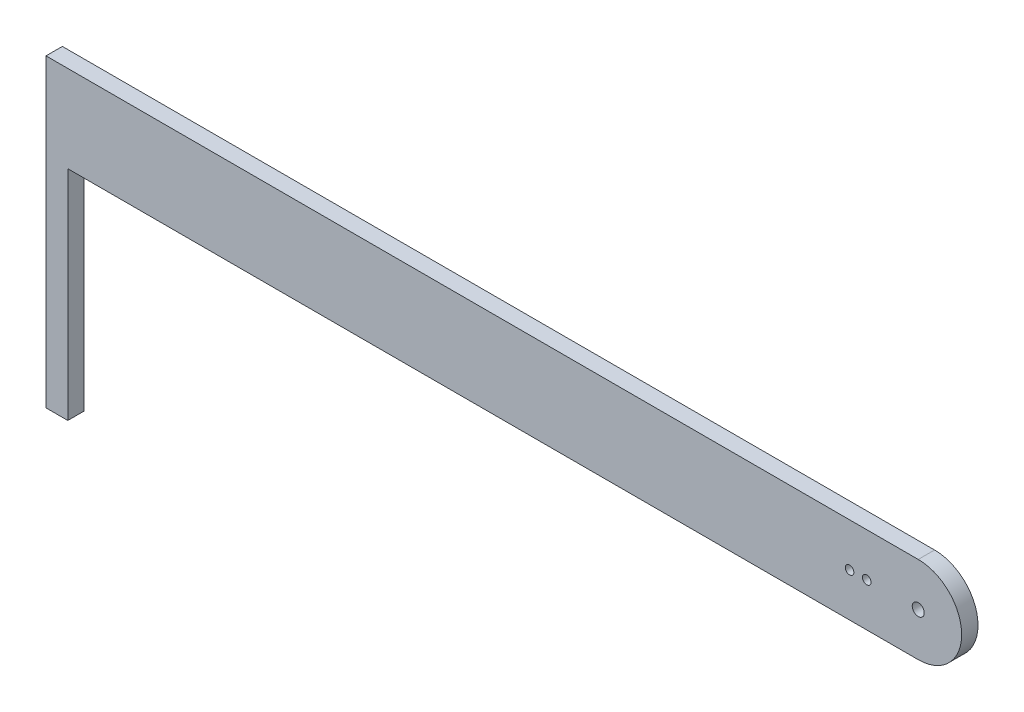
from build123d import *

# Parameters (mm, degrees)
BOSS_EXTRUDE1_DEPTH = 4.7625
SKETCH3_R           = 1.25
CUT_EXTRUDE1_DEPTH  = 266.210067011
SKETCH4_R           = 1.75
CUT_EXTRUDE2_DEPTH  = 266.210067011


with BuildPart() as part:
    # Sketch1 → Boss-Extrude1 (new body)
    with BuildSketch(Plane.XY):
        with BuildLine():
            Line((0, 12.64261775), (-254, 12.64261775))
            Line((-254, 12.64261775), (-254, -12.64261775))
            Line((-254, -12.64261775), (-254, -76.14261775))
            Line((-254, -76.14261775), (-247.65, -76.14261775))
            Line((-247.65, -76.14261775), (-247.65, -12.64261775))
            Line((-247.65, -12.64261775), (0, -12.64261775))
            ThreePointArc((0, -12.64261775), (12.64261775, 0), (0, 12.64261775))
        make_face()
    extrude(amount=BOSS_EXTRUDE1_DEPTH)

    # Sketch3 → Cut-Extrude1 (cut, through all)
    with BuildSketch(Plane.XY.offset(4.7625)):
        with Locations((-15, 0)):
            Circle(SKETCH3_R)
        with Locations((-20, 0)):
            Circle(SKETCH3_R)
    extrude(amount=-CUT_EXTRUDE1_DEPTH, mode=Mode.SUBTRACT)

    # Sketch4 → Cut-Extrude2 (cut, through all)
    with BuildSketch(Plane.XY.offset(4.7625)):
        Circle(SKETCH4_R)
    extrude(amount=-CUT_EXTRUDE2_DEPTH, mode=Mode.SUBTRACT)


solid = part.part
